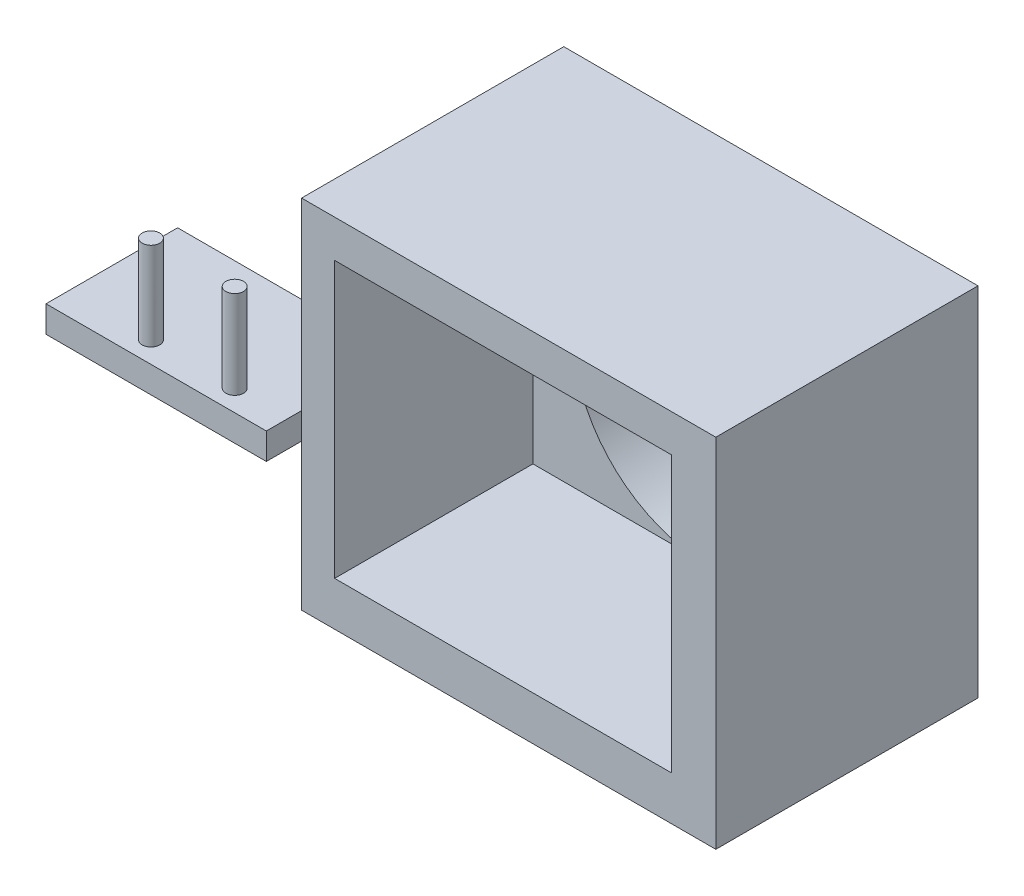
from build123d import *

# Parameters (mm, degrees)
CROQUIS1_W              = 47
CROQUIS1_H              = 40.5
SALIENTE_EXTRUIR1_DEPTH = 25
CROQUIS2_W              = 10.933851529
CROQUIS2_H              = 3
SALIENTE_EXTRUIR2_DEPTH = 25
CROQUIS3_W              = 38.25
CROQUIS3_H              = 31.25
CORTAR_EXTRUIR1_DEPTH   = 22.5
CROQUIS6_R              = 15.25
CORTAR_EXTRUIR2_DEPTH   = 10
SALIENTE_EXTRUIR5_START = 4.75
CROQUIS7_W              = 47
CROQUIS7_H              = 40.5
CROQUIS7_R              = 15.25
SALIENTE_EXTRUIR5_DEPTH = 4.75
CROQUIS8_W              = 25
CROQUIS8_H              = 4
SALIENTE_EXTRUIR6_DEPTH = 3
CROQUIS9_R              = 1
SALIENTE_EXTRUIR7_DEPTH = 10


with BuildPart() as part:
    # Croquis1 → Saliente-Extruir1 (new body)
    with BuildSketch(Plane.XY.offset(25)):
        with Locations((-22.24307249, 34.18630066)):
            Rectangle(CROQUIS1_W, CROQUIS1_H)
    extrude(amount=-SALIENTE_EXTRUIR1_DEPTH)

    # Croquis2 → Saliente-Extruir2 (add)
    with BuildSketch(Plane.ZY.offset(45.74307249)):
        with Locations((19.533074236, 32.04630066)):
            Rectangle(CROQUIS2_W, CROQUIS2_H)
    extrude(amount=SALIENTE_EXTRUIR2_DEPTH)

    # Croquis3 → Cortar-Extruir1 (cut)
    with BuildSketch(Plane.XY.offset(25)):
        with Locations((-22.86807249, 34.56130066)):
            Rectangle(CROQUIS3_W, CROQUIS3_H)
    extrude(amount=-CORTAR_EXTRUIR1_DEPTH, mode=Mode.SUBTRACT)

    # Croquis6 → Cortar-Extruir2 (cut)
    with BuildSketch(Plane(origin=(0, 0, 0), x_dir=(-1, 0, 0), z_dir=(0, 0, -1))):
        with Locations((22.24307249, 34.18630066)):
            Circle(CROQUIS6_R)
    extrude(amount=-CORTAR_EXTRUIR2_DEPTH, mode=Mode.SUBTRACT)

    # Croquis7 → Saliente-Extruir5 (add)
    with BuildSketch(Plane(origin=(0, 0, 0), x_dir=(-1, 0, 0), z_dir=(0, 0, -1)).offset(SALIENTE_EXTRUIR5_START)):
        with Locations((22.24307249, 34.18630066)):
            Rectangle(CROQUIS7_W, CROQUIS7_H)
        with Locations((22.24307249, 34.18630066)):
            Circle(CROQUIS7_R, mode=Mode.SUBTRACT)
    extrude(amount=-SALIENTE_EXTRUIR5_DEPTH)

    # Croquis8 → Saliente-Extruir6 (add)
    with BuildSketch(Plane(origin=(0, 33.54630066, 0), x_dir=(1, 0, 0), z_dir=(0, 1, 0))):
        with Locations((-58.24307249, -27)):
            Rectangle(CROQUIS8_W, CROQUIS8_H)
    extrude(amount=-SALIENTE_EXTRUIR6_DEPTH)

    # Croquis9 → Saliente-Extruir7 (add)
    with BuildSketch(Plane(origin=(0, 33.54630066, 0), x_dir=(1, 0, 0), z_dir=(0, 1, 0))):
        with Locations(Location((-61.24307249, -26.590447053, 0), (0, 0, 90))):
            Circle(CROQUIS9_R)
        with Locations(Location((-51.74307249, -26.590447053, 0), (0, 0, 90))):
            Circle(CROQUIS9_R)
    extrude(amount=SALIENTE_EXTRUIR7_DEPTH)


solid = part.part
